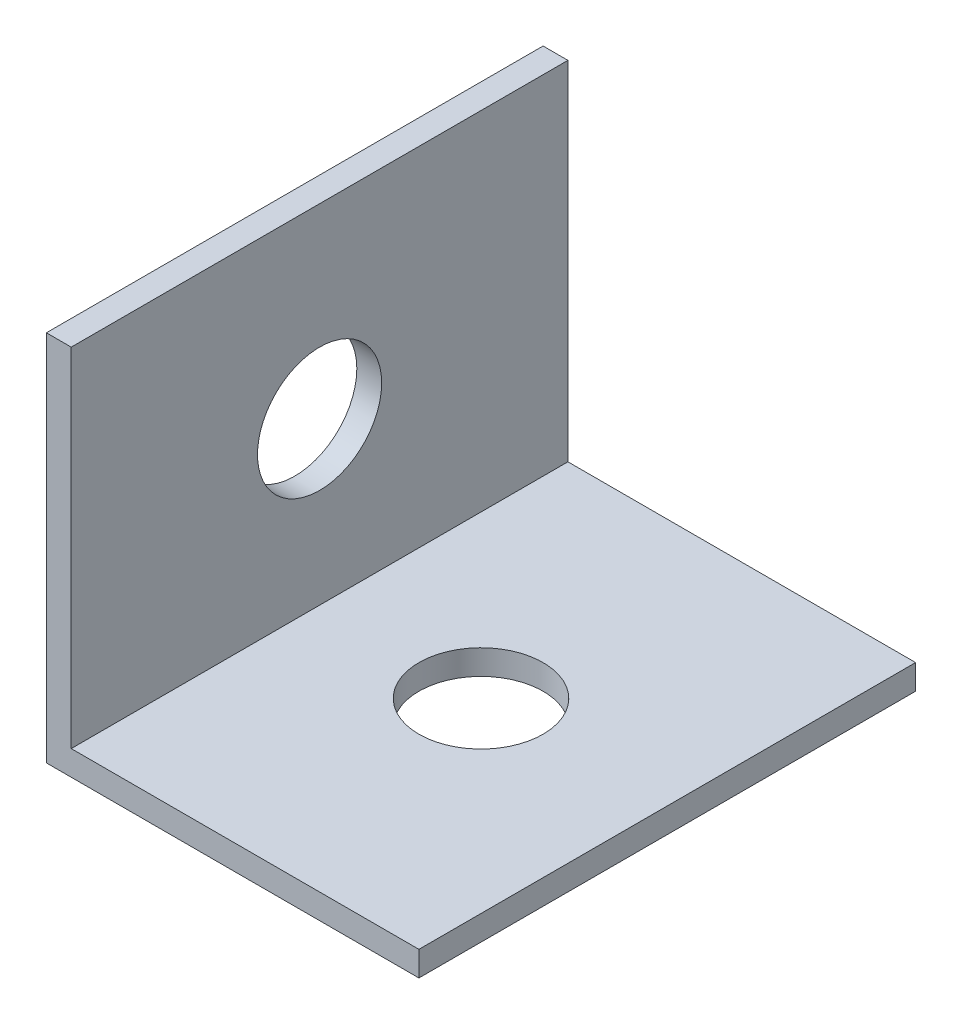
from build123d import *

# Parameters (mm, degrees)
BOSS_EXTRUDE1_DEPTH       = 50.8
F_97_0_5_DIAMETER_HOLE1_D = 12.7
F_97_0_5_DIAMETER_HOLE2_D = 12.7


with BuildPart() as part:
    # Sketch1 → Boss-Extrude1 (new body)
    with BuildSketch(Plane.XY):
        Polygon((0, 0), (0, 38.1), (2.54, 38.1), (2.54, 2.54), (38.1, 2.54), (38.1, 0), align=None)
    extrude(amount=BOSS_EXTRUDE1_DEPTH)

    # #97 (0.5) Diameter Hole1 (through all)
    with Locations(Plane(origin=(2.54, 19.05, 25.4), x_dir=(0, 1, 0), z_dir=(1, 0, 0))):
        with Locations((0, 0)):
            Hole(F_97_0_5_DIAMETER_HOLE1_D / 2)

    # #97 (0.5) Diameter Hole2 (through all)
    with Locations(Plane(origin=(0, 2.54, 0), x_dir=(1, 0, 0), z_dir=(0, 1, 0))):
        with Locations((19.05, -25.4)):
            Hole(F_97_0_5_DIAMETER_HOLE2_D / 2)


solid = part.part
